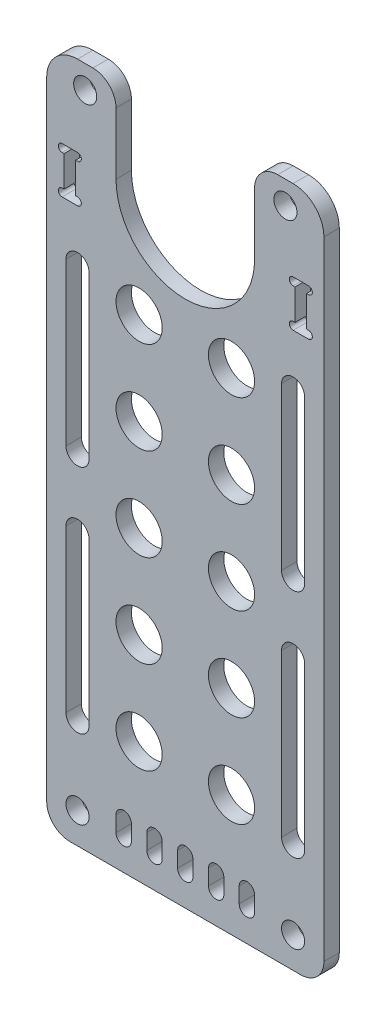
from build123d import *

# Parameters (mm, degrees)
SKETCH1_R           = 1.5
BOSS_EXTRUDE1_DEPTH = 2
FILLET1_R           = 3
FILLET2_R           = 3
SKETCH2_R           = 3
CUT_EXTRUDE1_DEPTH  = 58.905094767


with BuildPart() as part:
    # Sketch1 → Boss-Extrude1 (new body)
    with BuildSketch(Plane.XY):
        with BuildLine():
            Line((-18, 29.5), (-18, -33.5))
            Line((-18, -33.5), (18, -33.5))
            Line((18, -33.5), (18, 29.5))
            Line((18, 29.5), (18, 51))
            ThreePointArc((18, 51), (16.828427125, 53.828427125), (14, 55))
            Line((14, 55), (9, 55))
            Line((9, 55), (9, 44))
            ThreePointArc((9, 44), (0, 35), (-9, 44))
            Line((-9, 44), (-9, 55))
            Line((-9, 55), (-14, 55))
            ThreePointArc((-14, 55), (-16.828427125, 53.828427125), (-18, 51))
            Line((-18, 51), (-18, 29.5))
        make_face()
        with Locations((-14, -29.5)):
            Circle(SKETCH1_R, mode=Mode.SUBTRACT)
        with Locations((14, -29.5)):
            Circle(SKETCH1_R, mode=Mode.SUBTRACT)
        with Locations((-13, 52)):
            Circle(SKETCH1_R, mode=Mode.SUBTRACT)
        with Locations(Location((13, 52, 0), (0, 0, 180))):
            Circle(SKETCH1_R, mode=Mode.SUBTRACT)
    extrude(amount=BOSS_EXTRUDE1_DEPTH)

    # Fillet1
    fillet1_edges = [part.edges().sort_by_distance(p)[0] for p in [
        (18, -33.5, 1),
        (-18, -33.5, 1),
    ]]
    fillet(fillet1_edges, radius=FILLET1_R)

    # Fillet2
    fillet2_edges = [part.edges().sort_by_distance(p)[0] for p in [
        (-9, 55, 1),
        (9, 55, 1),
    ]]
    fillet(fillet2_edges, radius=FILLET2_R)

    # Sketch2 → Cut-Extrude1 (cut, through all)
    with BuildSketch(Plane.XY.offset(2)):
        with Locations((6, -17.75)):
            Circle(SKETCH2_R)
        with Locations(Location((-6, -17.75, 0), (0, 0, 180))):
            Circle(SKETCH2_R)
        with Locations(Location((-6, -5.75, 0), (0, 0, 180))):
            Circle(SKETCH2_R)
        with Locations((6, -5.75)):
            Circle(SKETCH2_R)
        with Locations(Location((-6, 6.25, 0), (0, 0, 180))):
            Circle(SKETCH2_R)
        with Locations((6, 6.25)):
            Circle(SKETCH2_R)
        with Locations(Location((-6, 18.25, 0), (0, 0, 180))):
            Circle(SKETCH2_R)
        with Locations((6, 18.25)):
            Circle(SKETCH2_R)
        with Locations(Location((-6, 30.25, 0), (0, 0, 180))):
            Circle(SKETCH2_R)
        with Locations((6, 30.25)):
            Circle(SKETCH2_R)
        with BuildLine():
            Line((-15.5, 1.75), (-15.5, -19.25))
            ThreePointArc((-15.5, -19.25), (-14, -20.75), (-12.5, -19.25))
            Line((-12.5, -19.25), (-12.5, 1.75))
            ThreePointArc((-12.5, 1.75), (-14, 3.25), (-15.5, 1.75))
        make_face()
        with BuildLine():
            Line((12.5, 1.75), (12.5, -19.25))
            ThreePointArc((12.5, -19.25), (14, -20.75), (15.5, -19.25))
            Line((15.5, -19.25), (15.5, 1.75))
            ThreePointArc((15.5, 1.75), (14, 3.25), (12.5, 1.75))
        make_face()
        with BuildLine():
            Line((-15.5, 31.75), (-15.5, 10.75))
            ThreePointArc((-15.5, 10.75), (-14, 9.25), (-12.5, 10.75))
            Line((-12.5, 10.75), (-12.5, 31.75))
            ThreePointArc((-12.5, 31.75), (-14, 33.25), (-15.5, 31.75))
        make_face()
        with BuildLine():
            Line((12.5, 31.75), (12.5, 10.75))
            ThreePointArc((12.5, 10.75), (14, 9.25), (15.5, 10.75))
            Line((15.5, 10.75), (15.5, 31.75))
            ThreePointArc((15.5, 31.75), (14, 33.25), (12.5, 31.75))
        make_face()
        with BuildLine():
            Line((-9, -29.5), (-9, -27.5))
            ThreePointArc((-9, -27.5), (-8, -26.5), (-7, -27.5))
            Line((-7, -27.5), (-7, -29.5))
            ThreePointArc((-7, -29.5), (-8, -30.5), (-9, -29.5))
        make_face()
        with BuildLine():
            Line((-5, -29.5), (-5, -27.5))
            ThreePointArc((-5, -27.5), (-4, -26.5), (-3, -27.5))
            Line((-3, -27.5), (-3, -29.5))
            ThreePointArc((-3, -29.5), (-4, -30.5), (-5, -29.5))
        make_face()
        with BuildLine():
            Line((-1, -29.5), (-1, -27.5))
            ThreePointArc((-1, -27.5), (0, -26.5), (1, -27.5))
            Line((1, -27.5), (1, -29.5))
            ThreePointArc((1, -29.5), (0, -30.5), (-1, -29.5))
        make_face()
        with BuildLine():
            Line((3, -29.5), (3, -27.5))
            ThreePointArc((3, -27.5), (4, -26.5), (5, -27.5))
            Line((5, -27.5), (5, -29.5))
            ThreePointArc((5, -29.5), (4, -30.5), (3, -29.5))
        make_face()
        with BuildLine():
            Line((7, -29.5), (7, -27.5))
            ThreePointArc((7, -27.5), (8, -26.5), (9, -27.5))
            Line((9, -27.5), (9, -29.5))
            ThreePointArc((9, -29.5), (8, -30.5), (7, -29.5))
        make_face()
        with BuildLine():
            Line((-16, 44.5), (-14, 44.5))
            ThreePointArc((-14, 44.5), (-13.5, 44), (-14, 43.5))
            Line((-14, 43.5), (-14.25, 43.5))
            Line((-14.25, 43.5), (-14.25, 39.5))
            Line((-14.25, 39.5), (-14, 39.5))
            ThreePointArc((-14, 39.5), (-13.5, 39), (-14, 38.5))
            Line((-14, 38.5), (-16, 38.5))
            ThreePointArc((-16, 38.5), (-16.5, 39), (-16, 39.5))
            Line((-16, 39.5), (-15.75, 39.5))
            Line((-15.75, 39.5), (-15.75, 43.5))
            Line((-15.75, 43.5), (-16, 43.5))
            ThreePointArc((-16, 43.5), (-16.5, 44), (-16, 44.5))
        make_face()
        with BuildLine():
            Line((14.25, 39.5), (14, 39.5))
            ThreePointArc((14, 39.5), (13.5, 39), (14, 38.5))
            Line((14, 38.5), (16, 38.5))
            ThreePointArc((16, 38.5), (16.5, 39), (16, 39.5))
            Line((16, 39.5), (15.75, 39.5))
            Line((15.75, 39.5), (15.75, 43.5))
            Line((15.75, 43.5), (16, 43.5))
            ThreePointArc((16, 43.5), (16.5, 44), (16, 44.5))
            Line((16, 44.5), (14, 44.5))
            ThreePointArc((14, 44.5), (13.5, 44), (14, 43.5))
            Line((14, 43.5), (14.25, 43.5))
            Line((14.25, 43.5), (14.25, 39.5))
        make_face()
    extrude(amount=-CUT_EXTRUDE1_DEPTH, mode=Mode.SUBTRACT)


solid = part.part
